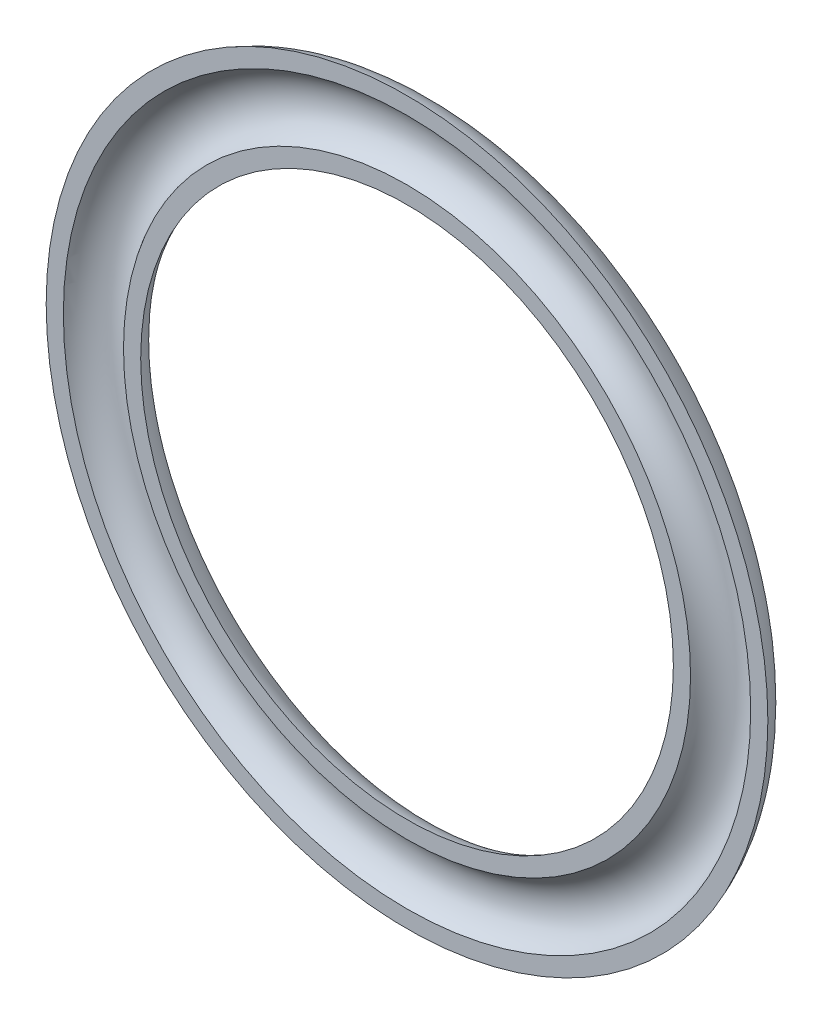
from build123d import *

# Parameters (mm, degrees)
SKETCH_1_R          = 21
SKETCH_1_R_2        = 15.5
EXTRUDE_1_DEPTH     = 2
CUT_EXTRUDE_START   = -2
SKETCH_3_R          = 21
CUT_EXTRUDE_1_DEPTH = 2


with BuildPart() as part:
    # 草图1 → 凸台-拉伸1 (new body)
    with BuildSketch(Plane.XY):
        Circle(SKETCH_1_R)
        Circle(SKETCH_1_R_2, mode=Mode.SUBTRACT)
    extrude(amount=EXTRUDE_1_DEPTH)

    # 草图2 → 旋转1 (revolve)
    with BuildSketch(Plane(origin=(0, 0, 0), x_dir=(1, 0, 0), z_dir=(0, 1, 0)), mode=Mode.PRIVATE) as revolve_1_sk:
        with BuildLine():
            Line((-21, 0), (-20, 0))
            ThreePointArc((-20, 0), (-18.25, 1.090097064), (-16.5, 0))
            Line((-16.5, 0), (-15.5, 0))
            ThreePointArc((-15.5, 0), (-18.25, 2.021587034), (-21, 0))
        make_face()
    revolve(revolve_1_sk.sketch.rotate(Axis((0, 0, 0), (0, 0, -1)), 180), axis=Axis((0, 0, 0), (0, 0, -1)))

    # 草图3 → 切除-拉伸1 (cut)
    with BuildSketch(Plane.XY.offset(2).offset(CUT_EXTRUDE_START)):
        Circle(SKETCH_3_R)
    extrude(amount=CUT_EXTRUDE_1_DEPTH, mode=Mode.SUBTRACT)


solid = part.part
